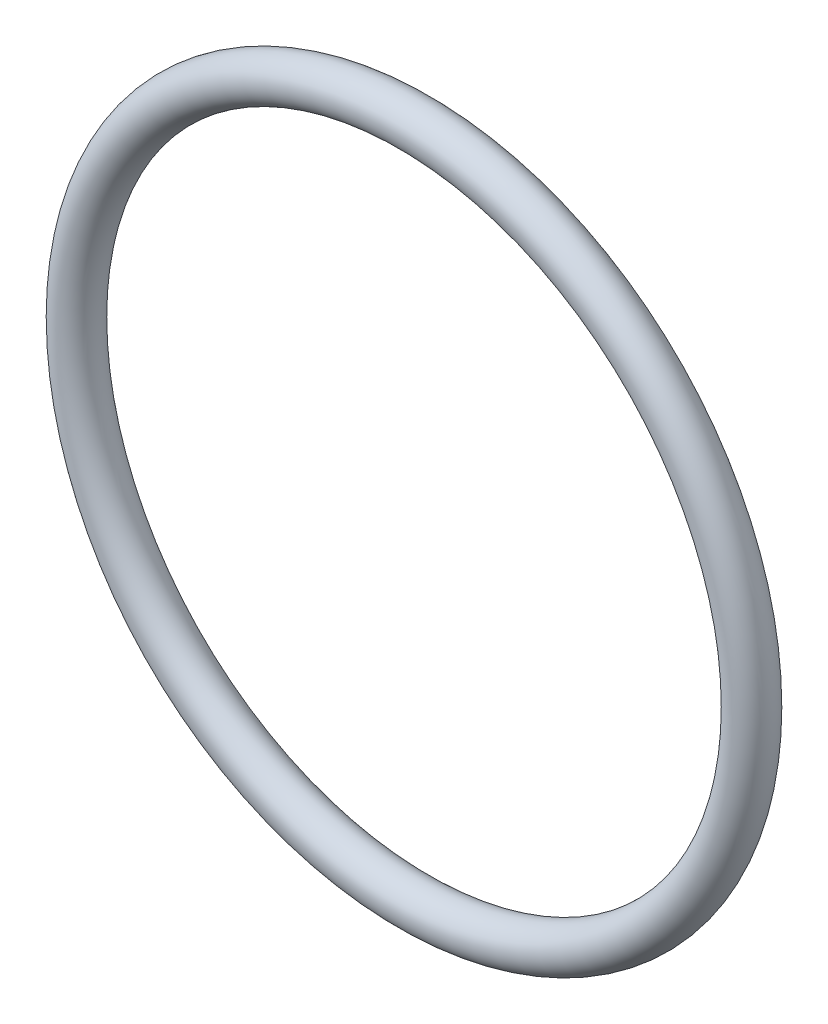
from build123d import *

# Parameters (mm, degrees)
SKETCH1_R = 2.667


with BuildPart() as part:
    # Sketch1 → Revolve1 (revolve)
    with BuildSketch(Plane(origin=(0, 0, 0), x_dir=(0, -1, 0), z_dir=(1, 0, 0)), mode=Mode.PRIVATE) as revolve1_sk:
        with Locations((42.037, 0)):
            Circle(SKETCH1_R)
    revolve(revolve1_sk.sketch.rotate(Axis((0, 0, 2.667), (0, 0, -1)), 270), axis=Axis((0, 0, 2.667), (0, 0, -1)))


solid = part.part
